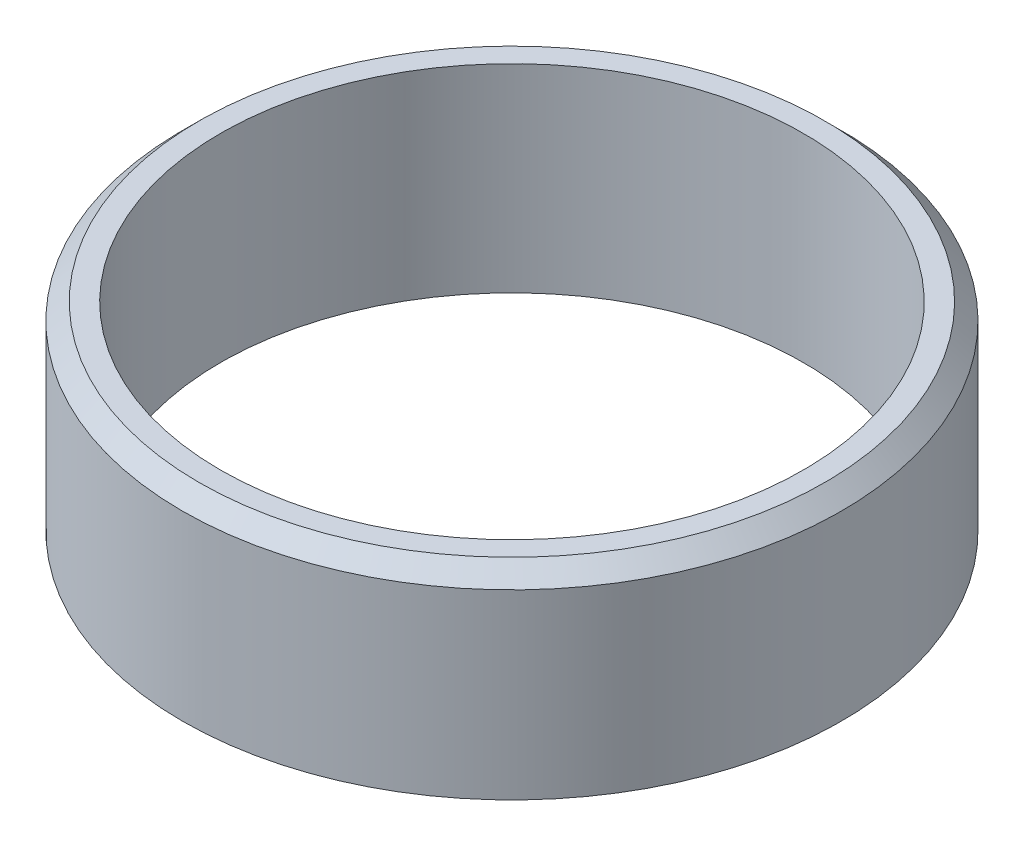
from build123d import *

# Parameters (mm, degrees)
SKETCH1_R           = 19.925
SKETCH1_R_2         = 17.625
BOSS_EXTRUDE1_DEPTH = 12
CHAMFER1_SIZE       = 1


with BuildPart() as part:
    # Sketch1 → Boss-Extrude1 (new body)
    with BuildSketch(Plane(origin=(0, 0, 0), x_dir=(1, 0, 0), z_dir=(0, 1, 0))):
        with Locations(Location((0, 0, 0), (0, 0, 270))):
            Circle(SKETCH1_R)
        with Locations(Location((0, 0, 0), (0, 0, 270))):
            Circle(SKETCH1_R_2, mode=Mode.SUBTRACT)
    extrude(amount=BOSS_EXTRUDE1_DEPTH)

    # Chamfer1
    chamfer1_edges = [part.edges().sort_by_distance(p)[0] for p in [
        (0, 12, -19.925),
    ]]
    chamfer(chamfer1_edges, length=CHAMFER1_SIZE)


solid = part.part
